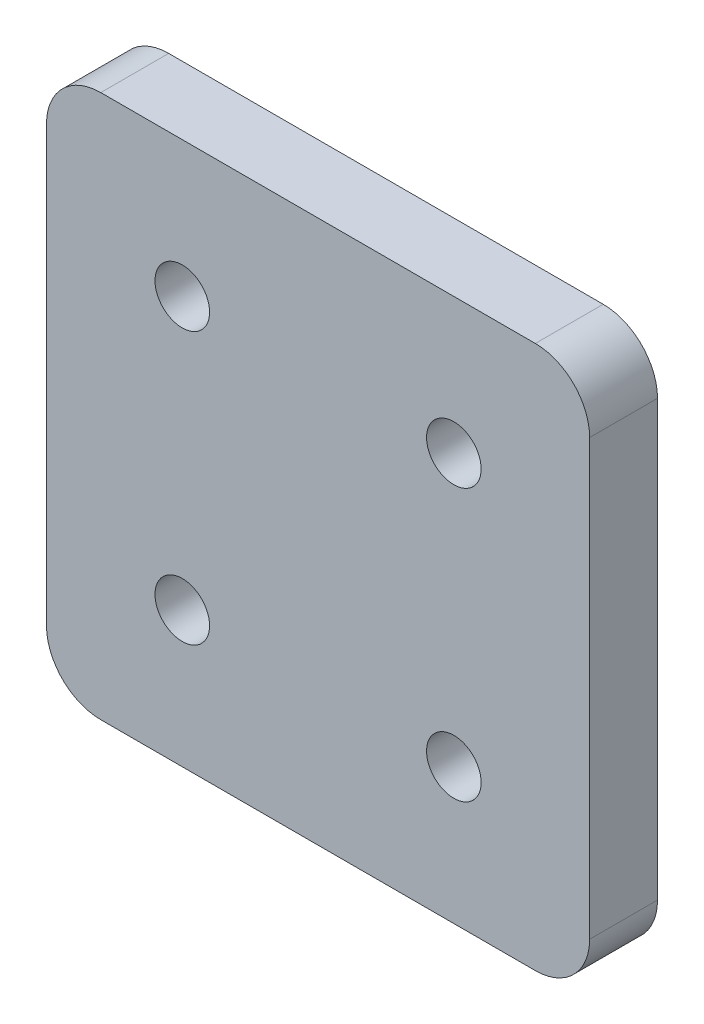
from build123d import *

# Parameters (mm, degrees)
SKETCH1_R           = 2.5527
BOSS_EXTRUDE1_DEPTH = 6.35
CUT_EXTRUDE1_DEPTH  = 85.78424365


with BuildPart() as part:
    # Sketch1 → Boss-Extrude1 (new body)
    with BuildSketch(Plane.XY):
        with BuildLine():
            Line((1.487897552, 1.487897552), (41.309178157, 41.309178157))
            ThreePointArc((41.309178157, 41.309178157), (44.901280605, 42.797075708), (48.493383054, 41.309178157))
            Line((48.493383054, 41.309178157), (66.094685051, 23.70787616))
            ThreePointArc((66.094685051, 23.70787616), (67.582582603, 20.115773711), (66.094685051, 16.523671263))
            Line((66.094685051, 16.523671263), (0.25891134, -49.312102448))
            ThreePointArc((0.25891134, -49.312102448), (-1.389159272, -50.413308025), (-3.333191109, -50.8))
            Line((-3.333191109, -50.8), (-58.42, -50.8))
            ThreePointArc((-58.42, -50.8), (-62.012102448, -49.312102448), (-63.5, -45.72))
            Line((-63.5, -45.72), (-63.5, -5.08))
            ThreePointArc((-63.5, -5.08), (-62.012102448, -1.487897552), (-58.42, 0))
            Line((-58.42, 0), (-2.104204897, 0))
            ThreePointArc((-2.104204897, 0), (-0.16017306, 0.386691975), (1.487897552, 1.487897552))
        make_face()
        with Locations((-50.8, -12.7)):
            Circle(SKETCH1_R, mode=Mode.SUBTRACT)
        with Locations((-25.4, -12.7)):
            Circle(SKETCH1_R, mode=Mode.SUBTRACT)
        with Locations((-25.4, -38.1)):
            Circle(SKETCH1_R, mode=Mode.SUBTRACT)
        with Locations((-50.8, -38.1)):
            Circle(SKETCH1_R, mode=Mode.SUBTRACT)
    extrude(amount=BOSS_EXTRUDE1_DEPTH)

    # Sketch2 → Cut-Extrude1 (cut, through all)
    with BuildSketch(Plane.XY.offset(6.35)):
        with BuildLine():
            Line((-2.104204897, 0), (-17.78, 0))
            ThreePointArc((-17.78, 0), (-14.187897552, -1.487897552), (-12.7, -5.08))
            Line((-12.7, -5.08), (-12.7, -45.72))
            ThreePointArc((-12.7, -45.72), (-14.187897552, -49.312102448), (-17.78, -50.8))
            Line((-17.78, -50.8), (-3.333191109, -50.8))
            ThreePointArc((-3.333191109, -50.8), (-1.389159272, -50.413308025), (0.25891134, -49.312102448))
            Line((0.25891134, -49.312102448), (66.094685051, 16.523671263))
            ThreePointArc((66.094685051, 16.523671263), (67.582582603, 20.115773711), (66.094685051, 23.70787616))
            Line((66.094685051, 23.70787616), (48.493383054, 41.309178157))
            ThreePointArc((48.493383054, 41.309178157), (44.901280605, 42.797075708), (41.309178157, 41.309178157))
            Line((41.309178157, 41.309178157), (1.487897552, 1.487897552))
            ThreePointArc((1.487897552, 1.487897552), (-0.16017306, 0.386691975), (-2.104204897, 0))
        make_face()
    extrude(amount=-CUT_EXTRUDE1_DEPTH, mode=Mode.SUBTRACT)


solid = part.part
